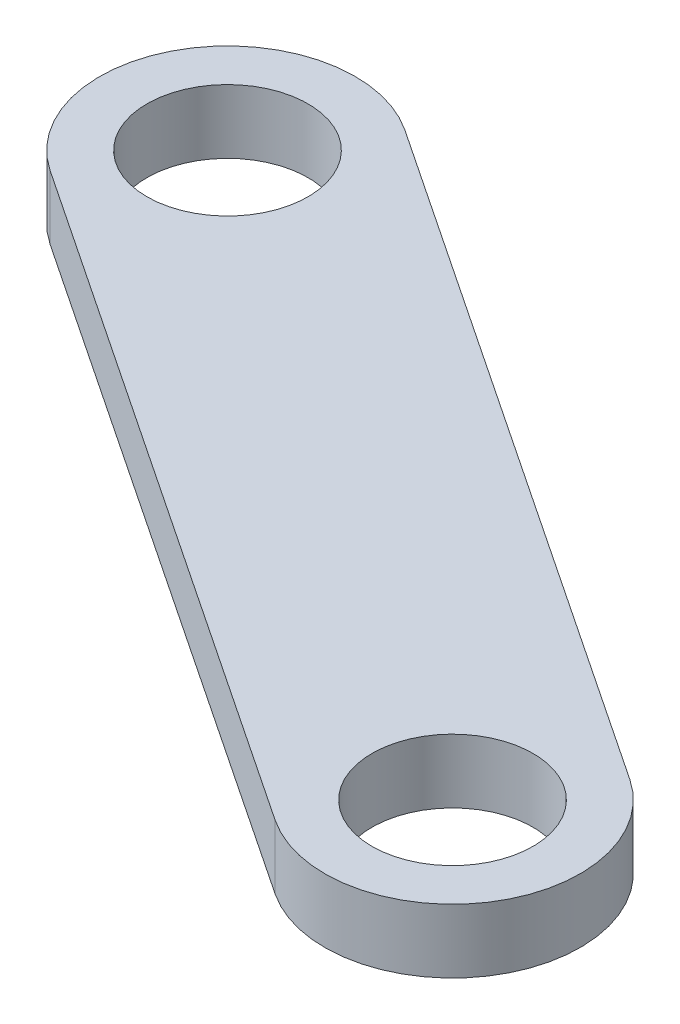
from build123d import *

# Parameters (mm, degrees)
SKETCH1_R           = 2
BOSS_EXTRUDE1_DEPTH = 1.5875


with BuildPart() as part:
    # Sketch1 → Boss-Extrude1 (new body)
    with BuildSketch(Plane(origin=(0, 0, 0), x_dir=(1, 0, 0), z_dir=(0, 1, 0))):
        with BuildLine():
            Line((15.002826877, -13.817759685), (-1.761173123, -2.641759685))
            ThreePointArc((-1.761173123, -2.641759685), (-2.641759685, 1.761173123), (1.761173123, 2.641759685))
            Line((1.761173123, 2.641759685), (18.525173123, -8.534240315))
            ThreePointArc((18.525173123, -8.534240315), (19.405759685, -12.937173123), (15.002826877, -13.817759685))
        make_face()
        with Locations(Location((0, 0, 0), (0, 0, 270))):
            Circle(SKETCH1_R, mode=Mode.SUBTRACT)
        with Locations(Location((16.764, -11.176, 0), (0, 0, 270))):
            Circle(SKETCH1_R, mode=Mode.SUBTRACT)
    extrude(amount=BOSS_EXTRUDE1_DEPTH)


solid = part.part
